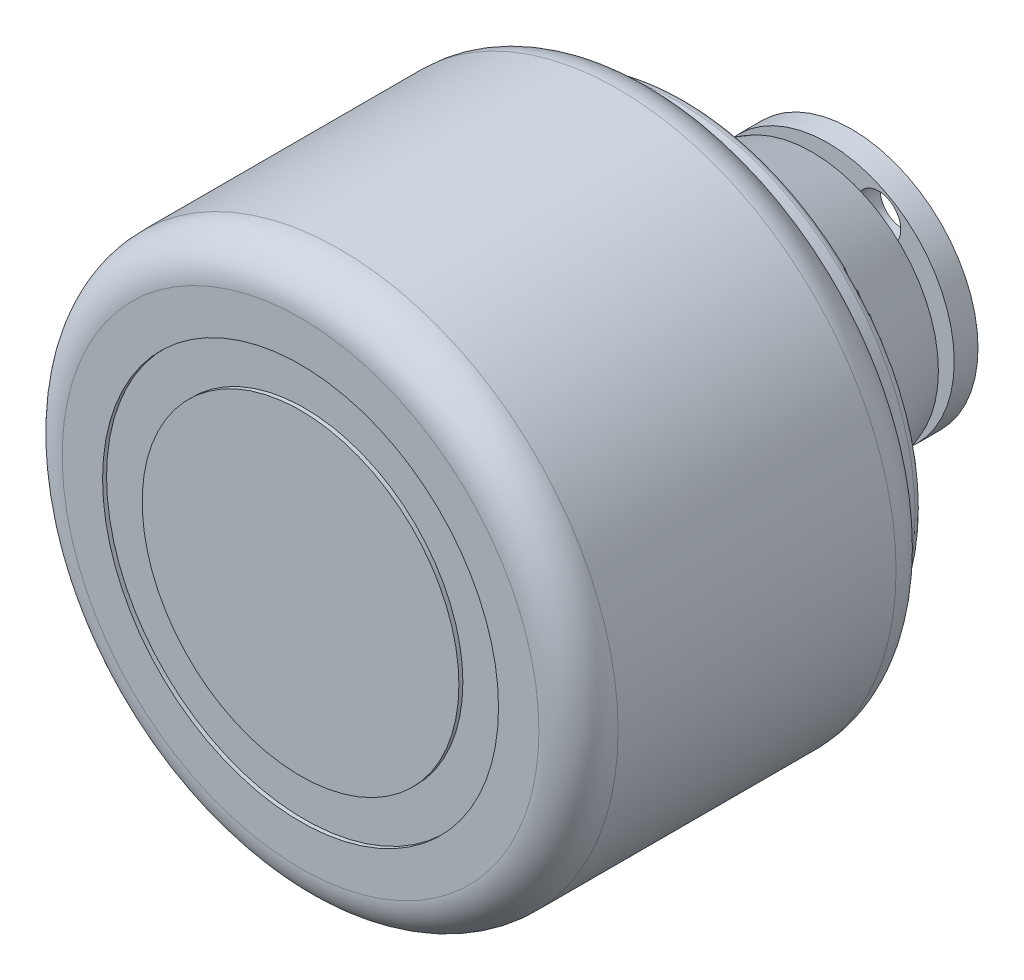
from build123d import *

# Parameters (mm, degrees)
SKETCH_1_R          = 35.1
EXTRUDE_1_DEPTH     = 45.1
SKETCH_3_R          = 30
SKETCH_3_R_2        = 20
EXTRUDE_2_DEPTH     = 3.5
SKETCH_3_4_R        = 20
EXTRUDE_3_DEPTH     = 24.5
FILLET_1_R          = 5
FILLET_2_R          = 20
FILLET_3_R          = 1
SKETCH_6_R          = 2.8
CUT_EXTRUDE_1_DEPTH = 4
SKETCH_7_R          = 25
SKETCH_7_R_2        = 20
CUT_EXTRUDE_2_DEPTH = 0.5


with BuildPart() as part:
    # 스케치1 → 보스-돌출1 (new body)
    with BuildSketch(Plane.XY):
        Circle(SKETCH_1_R)
    extrude(amount=EXTRUDE_1_DEPTH)

    # 스케치3 → 보스-돌출2 (add)
    with BuildSketch(Plane.XY):
        Circle(SKETCH_3_R)
        Circle(SKETCH_3_R_2, mode=Mode.SUBTRACT)
    extrude(amount=-EXTRUDE_2_DEPTH)

    # 스케치3<4> → 보스-돌출3 (add)
    with BuildSketch(Plane.XY):
        Circle(SKETCH_3_4_R)
    extrude(amount=-EXTRUDE_3_DEPTH)

    # 스케치4 → 컷-회전2 (revolve, cut)
    with BuildSketch(Plane(origin=(0, 0, 0), x_dir=(1, 0, 0), z_dir=(0, 1, 0))):
        Polygon((-15.95, 24.5), (-20, 24.5), (-20, 7.5), (-15.95, 19.5), (-4, 19.5), (-4, 21.5), (-15.95, 21.5), align=None)
    revolve(axis=Axis((0, 0, -24.5), (0, 0, -1)), mode=Mode.SUBTRACT)

    # 필렛1
    fillet_1_edges = [part.edges().sort_by_distance(p)[0] for p in [
        (-35.1, 0, 45.1),
        (-35.1, 0, 0),
    ]]
    fillet(fillet_1_edges, radius=FILLET_1_R)

    # 필렛2
    fillet_2_edges = [part.edges().sort_by_distance(p)[0] for p in [
        (0, -20, -7.5),
    ]]
    fillet(fillet_2_edges, radius=FILLET_2_R)

    # 필렛3
    fillet_3_edges = [part.edges().sort_by_distance(p)[0] for p in [
        (-30, 0, -3.5),
    ]]
    fillet(fillet_3_edges, radius=FILLET_3_R)

    # 스케치6 → 컷-돌출1 (cut)
    with BuildSketch(Plane(origin=(0, 0, -24.5), x_dir=(-1, 0, 0), z_dir=(0, 0, -1))):
        with Locations((12.8, 0)):
            Circle(SKETCH_6_R)
        with Locations((-6.4, 11.085125168)):
            Circle(SKETCH_6_R)
        with Locations((-6.4, -11.085125168)):
            Circle(SKETCH_6_R)
    extrude(amount=-CUT_EXTRUDE_1_DEPTH, mode=Mode.SUBTRACT)

    # 스케치7 → 컷-돌출2 (cut)
    with BuildSketch(Plane.XY.offset(45.1)):
        Circle(SKETCH_7_R)
        Circle(SKETCH_7_R_2, mode=Mode.SUBTRACT)
    extrude(amount=-CUT_EXTRUDE_2_DEPTH, mode=Mode.SUBTRACT)


solid = part.part
